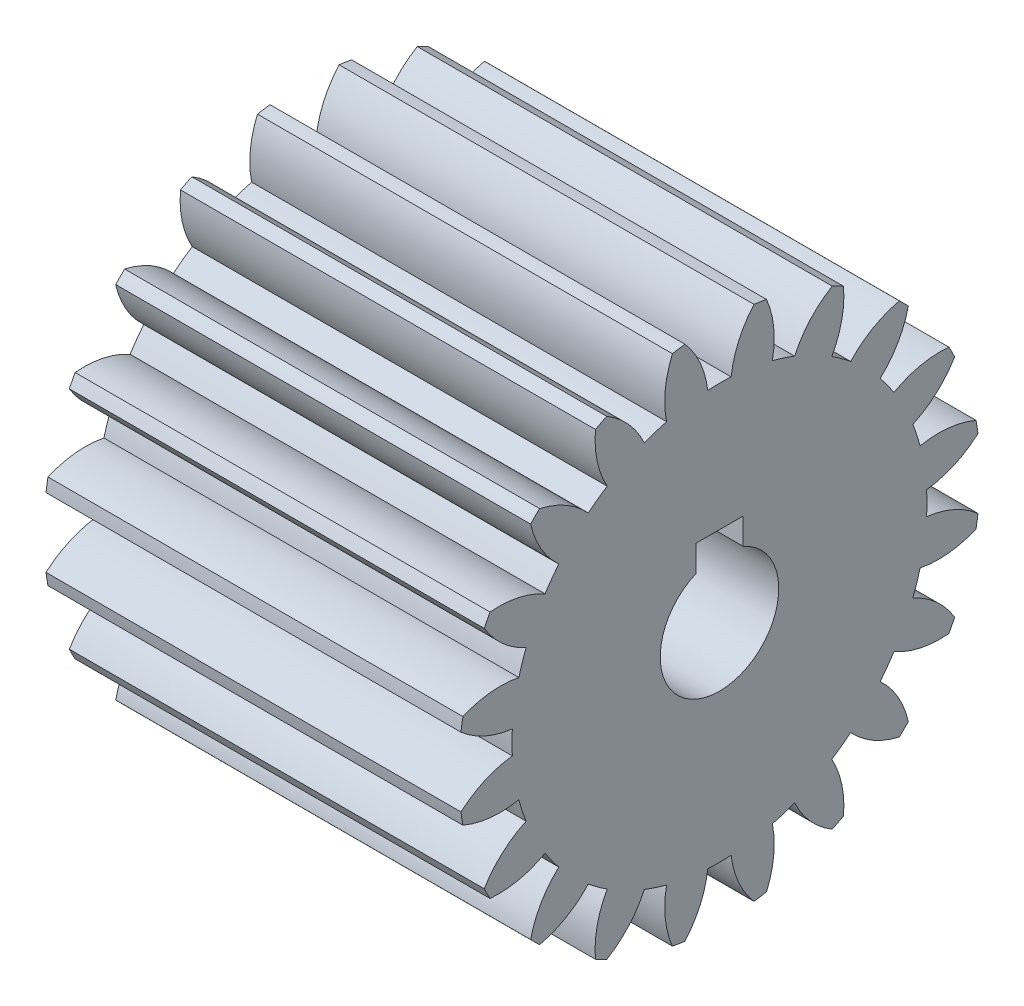
from build123d import *

# Parameters (mm, degrees)
BASPROSKE_W     = 35
BASPROSKE_H     = 22
TOOTHCUT_DEPTH  = 47.829477896
TEETHCUTS_COUNT = 20
TEETHCUTS_ANGLE = 342
BORSKE_R        = 5
BORE_DEPTH      = 50.0000508
KEYSKE_W        = 4
KEYSKE_H        = 6.8
KEYWAY_DEPTH    = 50.0000508


with BuildPart() as part:
    # BasProSke → Base-Revolve (revolve)
    with BuildSketch(Plane(origin=(0, 0, 0), x_dir=(1, 0, 0), z_dir=(0, 1, 0)), mode=Mode.PRIVATE) as base_revolve_sk:
        with Locations((17.5, 11)):
            Rectangle(BASPROSKE_W, BASPROSKE_H)
    revolve(base_revolve_sk.sketch.rotate(Axis((-10, 0, 0), (1, 0, 0)), 180), axis=Axis((-10, 0, 0), (1, 0, 0)))

    # TooCutSke → ToothCut (cut, through all)
    with BuildSketch(Plane(origin=(0, 0, 0), x_dir=(0, 0, -1), z_dir=(1, 0, 0))):
        with BuildLine():
            ThreePointArc((0.986171591, 17.471189616), (0, 17.499), (-0.986171591, 17.471189616))
            ThreePointArc((-0.986171591, 17.471189616), (-1.626916196, 19.798789858), (-2.932850173, 21.829260982))
            ThreePointArc((-2.932850173, 21.829260982), (0, 22.0254), (2.932850173, 21.829260982))
            ThreePointArc((2.932850173, 21.829260982), (1.626916196, 19.798789858), (0.986171591, 17.471189616))
        make_face()
    toothcut = extrude(amount=TOOTHCUT_DEPTH, mode=Mode.SUBTRACT)

    # TeethCuts: ToothCut ×20 about axis
    teethcuts_axis = Axis((-10, 0, 0), (1, 0, 0))
    for i in range(1, TEETHCUTS_COUNT):
        add(toothcut.rotate(teethcuts_axis, i * TEETHCUTS_ANGLE / (TEETHCUTS_COUNT - 1)), mode=Mode.SUBTRACT)

    # BorSke → Bore (cut, symmetric)
    with BuildSketch(Plane(origin=(0, 0, 0), x_dir=(0, 0, -1), z_dir=(1, 0, 0))):
        with Locations(Location((0, 0, 0), (0, 0, 180))):
            Circle(BORSKE_R)
    extrude(amount=BORE_DEPTH, both=True, mode=Mode.SUBTRACT)

    # KeySke → Keyway (cut, symmetric)
    with BuildSketch(Plane(origin=(0, 0, 0), x_dir=(0, 0, -1), z_dir=(1, 0, 0))):
        with Locations((0, 3.4)):
            Rectangle(KEYSKE_W, KEYSKE_H)
    extrude(amount=KEYWAY_DEPTH, both=True, mode=Mode.SUBTRACT)


solid = part.part
